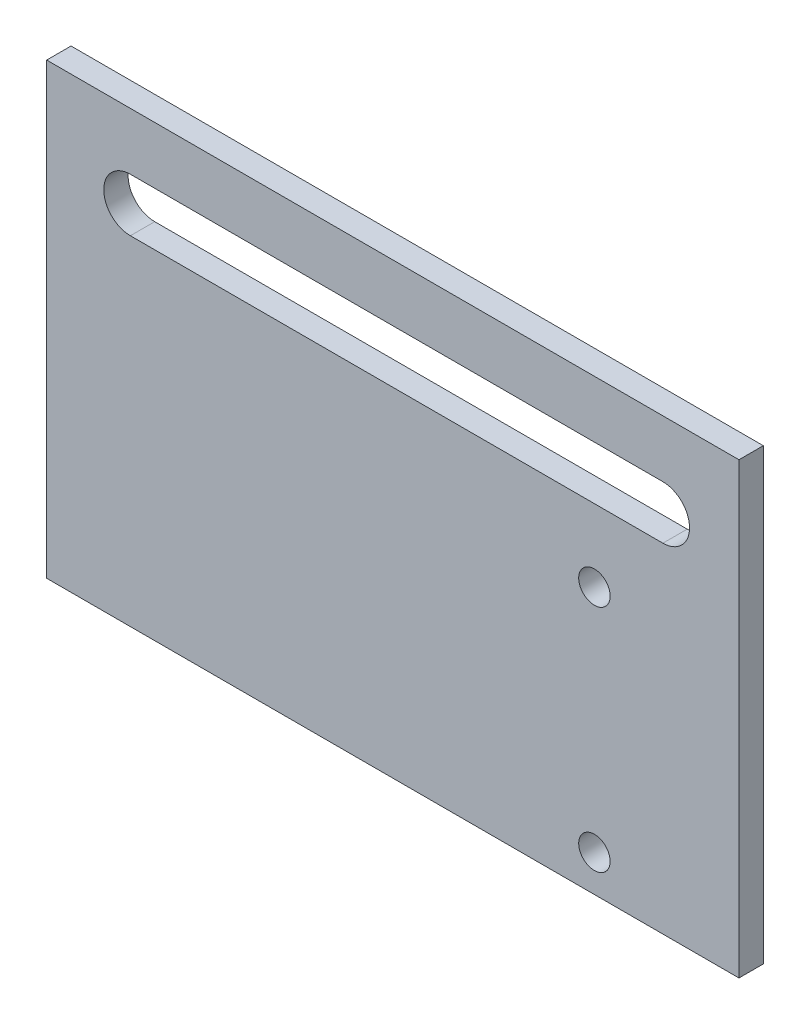
from build123d import *

# Parameters (mm, degrees)
SKETCH_1_W               = 91
SKETCH_1_H               = 59
EXTRUDE_1_DEPTH          = 3.2
CUT_EXTRUDE_1_DEPTH      = 109.499953917
CUT_EXTRUDE_1_DEPTH_BACK = 109.499953917
CUT_EXTRUDE_2_DEPTH      = 109.499953917
CUT_EXTRUDE_2_DEPTH_BACK = 109.499953917
SKETCH_3_R               = 2.067


with BuildPart() as part:
    # ｽｹｯﾁ1 → ﾎﾞｽ - 押し出し1 (new body)
    with BuildSketch(Plane.XY):
        with Locations((45.5, 29.5)):
            Rectangle(SKETCH_1_W, SKETCH_1_H)
    extrude(amount=EXTRUDE_1_DEPTH)

    # ｽｹｯﾁ2 → ｶｯﾄ - 押し出し1 (cut, two sides: drawn at the far end of the back side and taken through both)
    with BuildSketch(Plane.XY.offset(-CUT_EXTRUDE_1_DEPTH_BACK)):
        with BuildLine():
            Line((11, 51.5), (81, 51.5))
            ThreePointArc((81, 51.5), (84.5, 48), (81, 44.5))
            Line((81, 44.5), (11, 44.5))
            ThreePointArc((11, 44.5), (7.5, 48), (11, 51.5))
        make_face()
    extrude(amount=CUT_EXTRUDE_1_DEPTH + CUT_EXTRUDE_1_DEPTH_BACK, mode=Mode.SUBTRACT)

    # ｽｹｯﾁ3 → ｶｯﾄ - 押し出し2 (cut, two sides: drawn at the far end of the back side and taken through both)
    with BuildSketch(Plane.XY.offset(-CUT_EXTRUDE_2_DEPTH_BACK)):
        with Locations((72, 35)):
            Circle(SKETCH_3_R)
        with Locations((72, 4.8)):
            Circle(SKETCH_3_R)
    extrude(amount=CUT_EXTRUDE_2_DEPTH + CUT_EXTRUDE_2_DEPTH_BACK, mode=Mode.SUBTRACT)


solid = part.part
